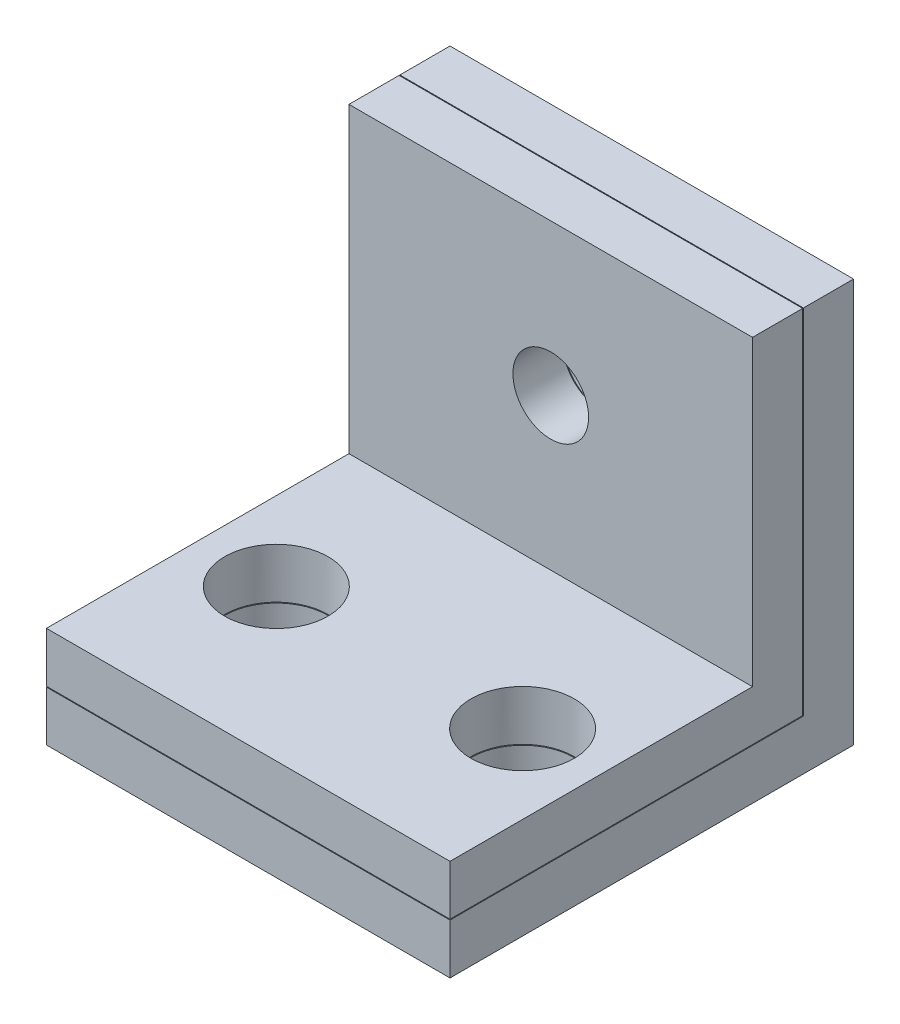
from build123d import *

# Parameters (mm, degrees)
SALIENTE_EXTRUIR1_DEPTH = 50.8
SALIENTE_EXTRUIR2_DEPTH = 50.8
CROQUIS4_R              = 6.5
CORTAR_EXTRUIR1_DEPTH   = 97.8
CROQUIS5_R              = 4.7625
CORTAR_EXTRUIR2_DEPTH   = 25


with BuildPart() as part:
    # Croquis1 → Saliente-Extruir1 (new body)
    with BuildSketch(Plane(origin=(0, 0, 0), x_dir=(0, 0, -1), z_dir=(1, 0, 0))):
        Polygon((0, 0), (50.8, 0), (50.8, 50.8), (44.49, 50.8), (44.49, 6.31), (0, 6.31), align=None)
    extrude(amount=SALIENTE_EXTRUIR1_DEPTH)


with BuildPart() as body_2:
    # Croquis2 → Saliente-Extruir2 (new body)
    with BuildSketch(Plane(origin=(50.8, 0, 0), x_dir=(0, 0, -1), z_dir=(1, 0, 0))):
        Polygon((0, 6.41), (44.39, 6.41), (44.39, 50.8), (38.08, 50.8), (38.08, 12.72), (0, 12.72), align=None)
    extrude(amount=-SALIENTE_EXTRUIR2_DEPTH)


with BuildPart() as cortar_extruir1_tool:
    # Croquis4 → Cortar-Extruir1 (new body)
    with BuildSketch(Plane(origin=(0, 12.72, 0), x_dir=(1, 0, 0), z_dir=(0, 1, 0))):
        with Locations(Location((9.9, 19.04, 0), (0, 0, 270))):
            Circle(CROQUIS4_R)
        with Locations(Location((40.9, 19.04, 0), (0, 0, 270))):
            Circle(CROQUIS4_R)
    extrude(amount=-CORTAR_EXTRUIR1_DEPTH)


with BuildPart() as part_1:
    add(part.part)

    # Cortar-Extruir1: cut by cortar_extruir1_tool
    add(cortar_extruir1_tool.part, mode=Mode.SUBTRACT)


with BuildPart() as body_2_1:
    add(body_2.part)

    # Cortar-Extruir1: cut by cortar_extruir1_tool
    add(cortar_extruir1_tool.part, mode=Mode.SUBTRACT)


with BuildPart() as cortar_extruir2_tool:
    # Croquis5 → Cortar-Extruir2 (new body)
    with BuildSketch(Plane.XY.offset(-38.08)):
        with Locations((25.4, 31.76)):
            Circle(CROQUIS5_R)
    extrude(amount=-CORTAR_EXTRUIR2_DEPTH)


with BuildPart() as part_2:
    add(part_1.part)

    # Cortar-Extruir2: cut by cortar_extruir2_tool
    add(cortar_extruir2_tool.part, mode=Mode.SUBTRACT)


with BuildPart() as body_2_2:
    add(body_2_1.part)

    # Cortar-Extruir2: cut by cortar_extruir2_tool
    add(cortar_extruir2_tool.part, mode=Mode.SUBTRACT)


solid = Compound([part_2.part, body_2_2.part])
